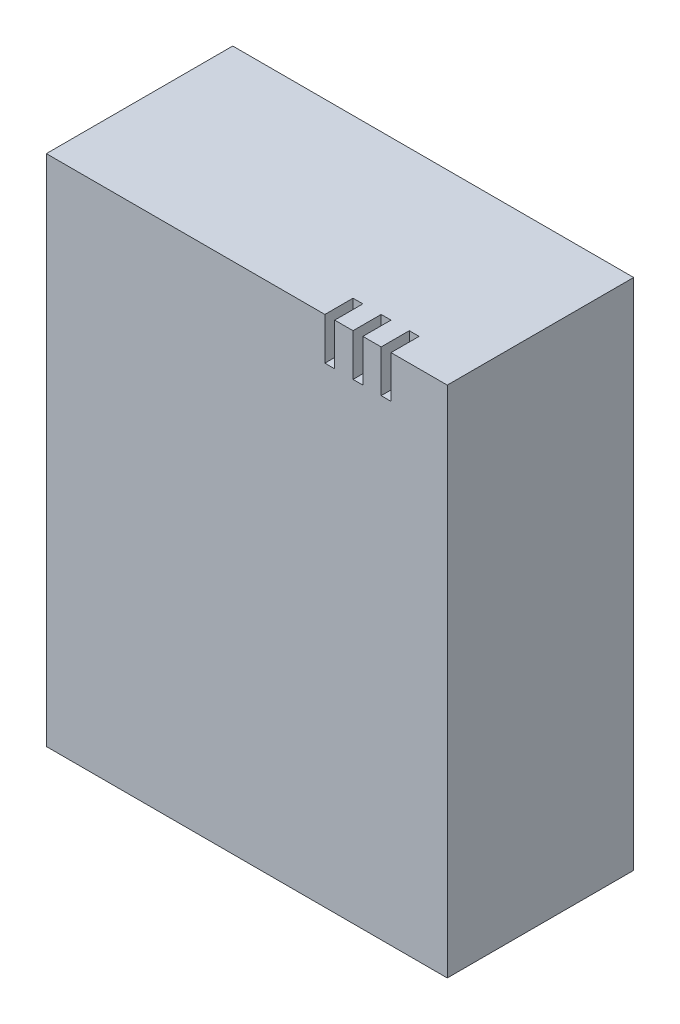
from build123d import *

# Parameters (mm, degrees)
SKETCH1_W           = 28.5
SKETCH1_H           = 13.25
BOSS_EXTRUDE1_DEPTH = 36.5
SKETCH2_W           = 0.7
SKETCH2_H           = 2
CUT_EXTRUDE1_DEPTH  = 3


with BuildPart() as part:
    # Sketch1 → Boss-Extrude1 (new body)
    with BuildSketch(Plane(origin=(0, 0, 0), x_dir=(1, 0, 0), z_dir=(0, 1, 0))):
        Rectangle(SKETCH1_W, SKETCH1_H)
    extrude(amount=BOSS_EXTRUDE1_DEPTH)

    # Sketch2 → Cut-Extrude1 (cut)
    with BuildSketch(Plane(origin=(0, 36.5, 0), x_dir=(1, 0, 0), z_dir=(0, 1, 0))):
        with Locations((9.9, -5.625)):
            Rectangle(SKETCH2_W, SKETCH2_H)
        with Locations((7.9, -5.625)):
            Rectangle(SKETCH2_W, SKETCH2_H)
        with Locations((5.9, -5.625)):
            Rectangle(SKETCH2_W, SKETCH2_H)
    extrude(amount=-CUT_EXTRUDE1_DEPTH, mode=Mode.SUBTRACT)


solid = part.part
